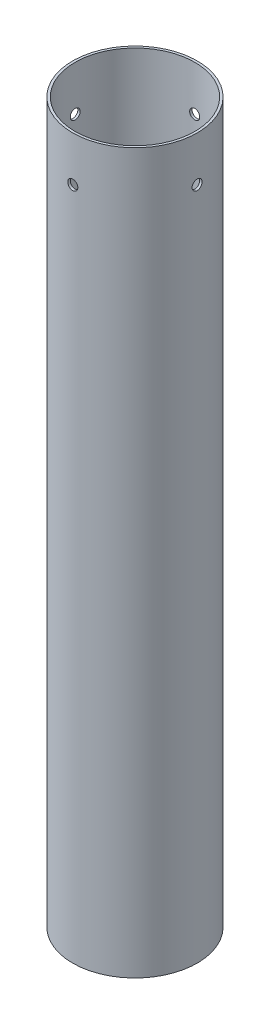
from build123d import *

# Parameters (mm, degrees)
SKETCH1_R           = 39.624
SKETCH1_R_2         = 38.1
BOSS_EXTRUDE1_DEPTH = 457.2
SKETCH2_R           = 3.175
CUT_EXTRUDE1_DEPTH  = 461.621279092
CIRPATTERN1_COUNT   = 4


with BuildPart() as part:
    # Sketch1 → Boss-Extrude1 (new body)
    with BuildSketch(Plane(origin=(0, 0, 0), x_dir=(1, 0, 0), z_dir=(0, 1, 0))):
        with Locations(Location((0, 0, 0), (0, 0, 270))):
            Circle(SKETCH1_R)
        with Locations(Location((0, 0, 0), (0, 0, 270))):
            Circle(SKETCH1_R_2, mode=Mode.SUBTRACT)
    extrude(amount=BOSS_EXTRUDE1_DEPTH)

    # Sketch2 → Cut-Extrude1 (cut, through all)
    with BuildSketch(Plane.XY):
        with Locations(Location((0, 428.625, 0), (0, 0, 270.000000034))):
            Circle(SKETCH2_R)
    cut_extrude1 = extrude(amount=CUT_EXTRUDE1_DEPTH, mode=Mode.SUBTRACT)

    # CirPattern1: Cut-Extrude1 ×4 about axis
    cirpattern1_axis = Axis((0, 457.2, 0), (0, -1, 0))
    for i in range(1, CIRPATTERN1_COUNT):
        add(cut_extrude1.rotate(cirpattern1_axis, i * 360 / CIRPATTERN1_COUNT), mode=Mode.SUBTRACT)


solid = part.part
